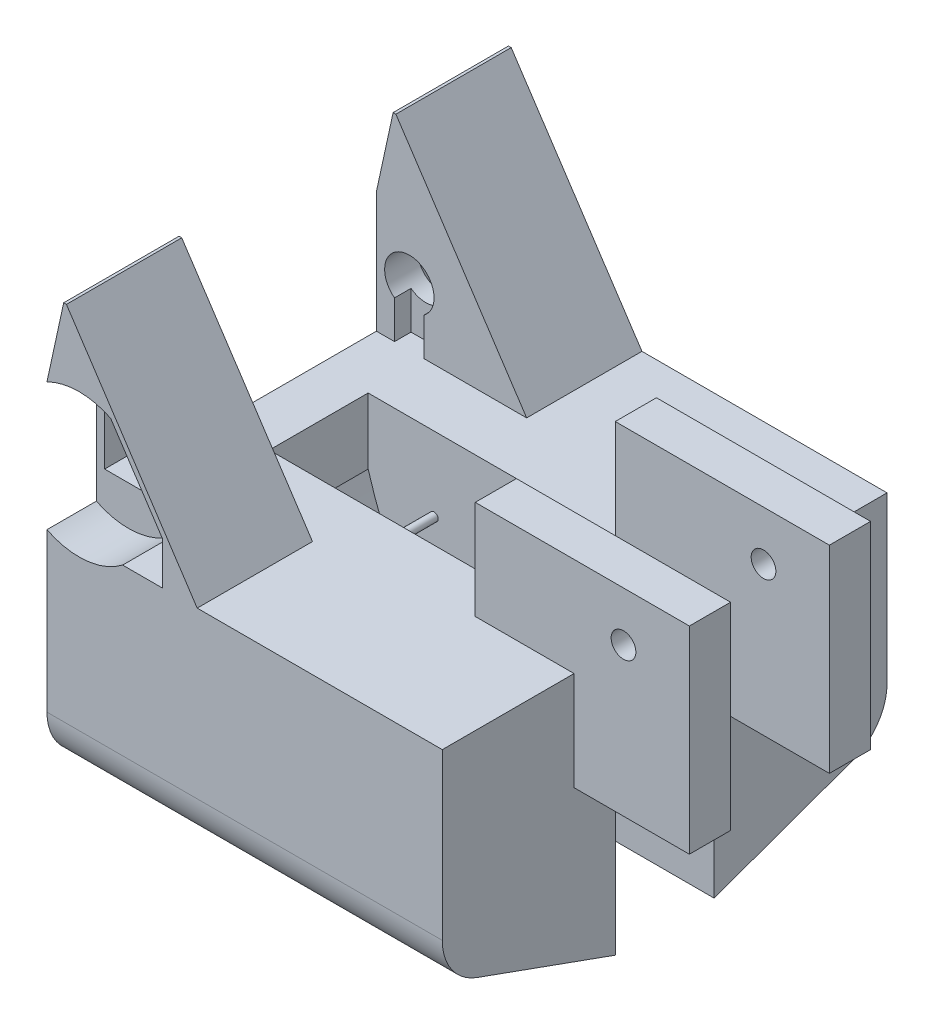
from build123d import *

# Parameters (mm, degrees)
EXTRUDE_1_DEPTH           = 30
EXTRUDE_2_DEPTH           = 210
SKETCH_8_W                = 25
SKETCH_8_H                = 120
EXTRUDE_5_DEPTH           = 70
SKETCH_9_W                = 25
SKETCH_9_H                = 60
EXTRUDE_6_DEPTH           = 60
SKETCH_10_R               = 7.5
CUT_EXTRUDE_3_DEPTH       = 402.372644808
EXTRUDE_7_DEPTH           = 60
EXTRUDE_8_REACH           = 392.16
SKETCH_12_R               = 2.5
SKETCH_14_W               = 125
SKETCH_14_H               = 50
EXTRUDE_9_DEPTH           = 120
SKETCH_15_W               = 70
SKETCH_15_H               = 70
CUT_EXTRUDE_4_DEPTH       = 10
CUT_EXTRUDE_5_DEPTH       = 20
SKETCH_17_R               = 43.471266984
CUT_EXTRUDE_6_DEPTH       = 428.317212384
EXTRUDE_10_DEPTH          = 20
EXTRUDE_11_DEPTH          = 20
CUT_EXTRUDE_7_DEPTH       = 434.012701892
CUT_EXTRUDE_8_DEPTH       = 434.012701892
EXTRUDE_19_REACH          = 446.86
EXTRUDE_20_DEPTH          = 20
EXTRUDE_21_DEPTH          = 20
EXTRUDE_START             = 20
EXTRUDE_22_DEPTH          = 20
CUT_EXTRUDE_9_DEPTH       = 30
CUT_EXTRUDE_11_DEPTH      = 407.201920232
CUT_EXTRUDE_11_DEPTH_BACK = 407.201920232
SKETCH_29_R               = 15
EXTRUDE_23_DEPTH          = 78.20324
SKETCH_33_W               = 30
SKETCH_33_H               = 40
CUT_EXTRUDE_14_DEPTH      = 20
SKETCH_34_W               = 18
SKETCH_34_H               = 35.300600551
CUT_EXTRUDE_15_DEPTH      = 10
CUT_EXTRUDE_16_DEPTH      = 10
SKETCH_36_RX              = 24.05
SKETCH_36_RY              = 15.9
SKETCH_36_R               = 15.9
CUT_EXTRUDE_17_DEPTH      = 4


with BuildPart() as part:
    # 草图1 → 凸台-拉伸1 (new body)
    with BuildSketch(Plane(origin=(0, 0, 0), x_dir=(0, 0, -1), z_dir=(1, 0, 0))):
        with BuildLine():
            Line((0, 0), (270, 0))
            Line((270, 0), (270, -100.282814983))
            ThreePointArc((270, -100.282814983), (264.178138298, -118.691056762), (248.830033233, -130.404003019))
            Line((248.830033233, -130.404003019), (142.45524498, -168.69892679))
            ThreePointArc((142.45524498, -168.69892679), (135, -170), (127.54475502, -168.69892679))
            Line((127.54475502, -168.69892679), (21.169966767, -130.404003019))
            ThreePointArc((21.169966767, -130.404003019), (5.821861702, -118.691056762), (0, -100.282814983))
            Line((0, -100.282814983), (0, 0))
        make_face()
    extrude(amount=EXTRUDE_1_DEPTH)

    # 草图2 → 凸台-拉伸2 (add)
    with BuildSketch(Plane(origin=(30, 0, 0), x_dir=(0, 0, -1), z_dir=(1, 0, 0))):
        with BuildLine():
            Line((105, -160.582814983), (105, 0))
            Line((105, 0), (0, 0))
            Line((0, 0), (0, -100.282814983))
            ThreePointArc((0, -100.282814983), (5.821861702, -118.691056762), (21.169966767, -130.404003019))
            Line((21.169966767, -130.404003019), (105, -160.582814983))
        make_face()
        with BuildLine():
            Line((270, 0), (165, 0))
            Line((165, 0), (165, -160.582814983))
            Line((165, -160.582814983), (248.830033233, -130.404003019))
            ThreePointArc((248.830033233, -130.404003019), (264.178138298, -118.691056762), (270, -100.282814983))
            Line((270, -100.282814983), (270, 0))
        make_face()
    extrude(amount=EXTRUDE_2_DEPTH)

    # 草图8 → 凸台-拉伸5 (add)
    with BuildSketch(Plane(origin=(240, 0, 0), x_dir=(0, 0, -1), z_dir=(1, 0, 0))):
        with Locations((92.5, 0)):
            Rectangle(SKETCH_8_W, SKETCH_8_H)
        with Locations((177.5, 0)):
            Rectangle(SKETCH_8_W, SKETCH_8_H)
    extrude(amount=EXTRUDE_5_DEPTH)

    # 草图9 → 凸台-拉伸6 (add)
    with BuildSketch(Plane.ZY.offset(-240)):
        with Locations((-92.5, 30)):
            Rectangle(SKETCH_9_W, SKETCH_9_H)
        with Locations((-177.5, 30)):
            Rectangle(SKETCH_9_W, SKETCH_9_H)
    extrude(amount=EXTRUDE_6_DEPTH)

    # 草图10 → 切除-拉伸3 (cut, through all)
    with BuildSketch(Plane.XY.offset(-80)):
        with Locations((270, 30)):
            Circle(SKETCH_10_R)
    extrude(amount=-CUT_EXTRUDE_3_DEPTH, mode=Mode.SUBTRACT)

    # 草图11 → 凸台-拉伸7 (add)
    with BuildSketch(Plane(origin=(0, 0, -105), x_dir=(-1, 0, 0), z_dir=(0, 0, -1))):
        with BuildLine():
            Line((-30, -40), (-30, -160.582814983))
            Line((-30, -160.582814983), (-108.203242822, -160.582814983))
            ThreePointArc((-108.203242822, -160.582814983), (-60.24964282, -106.032303748), (-30, -40))
        make_face()
    extrude(amount=EXTRUDE_7_DEPTH)

    # 草图12 → 凸台-拉伸8 (add, up to next)
    with BuildSketch(Plane.XY.offset(-165), mode=Mode.PRIVATE) as extrude_8_sk1:
        with Locations(Location((70, -45, 0), (0, 0, 180))):
            Circle(SKETCH_12_R)
    extrude_8_tool1 = extrude(extrude_8_sk1.sketch, amount=EXTRUDE_8_REACH, mode=Mode.PRIVATE) - part.part
    add(extrude_8_tool1.solids().sort_by_distance((70, -45, -165))[0])

    # 草图14 → 凸台-拉伸9 (add)
    with BuildSketch(Plane(origin=(0, 0, 0), x_dir=(1, 0, 0), z_dir=(0, 1, 0))):
        with Locations((62.5, 225)):
            Rectangle(SKETCH_14_W, SKETCH_14_H)
        with Locations((62.5, 45)):
            Rectangle(SKETCH_14_W, SKETCH_14_H)
    extrude(amount=EXTRUDE_9_DEPTH)

    # 草图15 → 切除-拉伸4 (cut)
    with BuildSketch(Plane.XY.offset(-20)):
        with Locations((35, 35)):
            Rectangle(SKETCH_15_W, SKETCH_15_H)
    extrude(amount=-CUT_EXTRUDE_4_DEPTH, mode=Mode.SUBTRACT)

    # 草图16 → 切除-拉伸5 (cut)
    with BuildSketch(Plane.XY.offset(-30)):
        Polygon((35, 15), (5, 15), (5, 55), (35, 55), (35, 35), align=None)
    extrude(amount=-CUT_EXTRUDE_5_DEPTH, mode=Mode.SUBTRACT)

    # 草图17 → 切除-拉伸6 (cut, through all)
    with BuildSketch(Plane.XY.offset(-30)):
        with Locations((19.5, 34.5)):
            Circle(SKETCH_17_R)
    extrude(amount=CUT_EXTRUDE_6_DEPTH, mode=Mode.SUBTRACT)

    # 草图18 → 凸台-拉伸10 (add)
    with BuildSketch(Plane.XY.offset(-20)):
        Polygon((11.819921283, 120), (91.211474189, 0), (87.317867735, 0), (10.741661946, 115.744614613), align=None)
    extrude(amount=EXTRUDE_10_DEPTH)

    # 草图19 → 凸台-拉伸11 (add)
    with BuildSketch(Plane.XY.offset(-20)):
        with BuildLine():
            Line((1.857343832, 74.230186717), (10.856035233, 115.571739869))
            Line((10.856035233, 115.571739869), (10.741661946, 115.744614613))
            Line((10.741661946, 115.744614613), (11.819921283, 120))
            Line((11.819921283, 120), (10.153664863, 120))
            Line((10.153664863, 120), (0, 73.352297914))
            ThreePointArc((0, 73.352297914), (0.923485284, 73.80221564), (1.857343832, 74.230186717))
        make_face()
    extrude(amount=EXTRUDE_11_DEPTH)

    # 草图20 → 切除-拉伸7 (cut, through all)
    with BuildSketch(Plane.XY.offset(-20)):
        Polygon((0, 120), (0, 73.352297914), (10.153664863, 120), align=None)
    extrude(amount=-CUT_EXTRUDE_7_DEPTH, mode=Mode.SUBTRACT)

    # 草图22 → 切除-拉伸8 (cut, through all)
    with BuildSketch(Plane.XY.offset(-20)):
        Polygon((44.899734993, 70), (70, 32.061054476), (91.211474189, 0), (125, 0), (125, 120), (11.819921283, 120), align=None)
    extrude(amount=-CUT_EXTRUDE_8_DEPTH, mode=Mode.SUBTRACT)

    # 草图23 → 凸台-拉伸19 (add, up to next)
    with BuildSketch(Plane.XY, mode=Mode.PRIVATE) as extrude_19_sk1:
        with BuildLine():
            Line((87.317867735, 0), (91.211474189, 0))
            Line((91.211474189, 0), (11.819921283, 120))
            Line((11.819921283, 120), (10.153664863, 120))
            Line((10.153664863, 120), (0, 73.352297914))
            ThreePointArc((0, 73.352297914), (0.923485284, 73.80221564), (1.857343832, 74.230186717))
            Line((1.857343832, 74.230186717), (10.856035233, 115.571739869))
            Line((10.856035233, 115.571739869), (87.317867735, 0))
        make_face()
    extrude_19_tool1 = extrude(extrude_19_sk1.sketch, amount=-EXTRUDE_19_REACH, mode=Mode.PRIVATE) - part.part
    add(extrude_19_tool1.solids().sort_by_distance((89.264671, 1.5073, 0))[0])

    # 草图24 → 凸台-拉伸20 (add)
    with BuildSketch(Plane.XY.offset(-20)):
        Polygon((87.317867735, 0), (70, 26.175884614), (70, 0), align=None)
    extrude(amount=EXTRUDE_20_DEPTH)

    # 草图25 → 凸台-拉伸21 (add)
    with BuildSketch(Plane.XY.offset(-20)):
        with BuildLine():
            Line((38.684579851, 73.509011127), (10.856035233, 115.571739869))
            Line((10.856035233, 115.571739869), (1.857343832, 74.230186717))
            ThreePointArc((1.857343832, 74.230186717), (20.351120273, 77.962934179), (38.684579851, 73.509011127))
        make_face()
    extrude(amount=EXTRUDE_21_DEPTH)

    # 草图26 → 凸台-拉伸22 (add)
    with BuildSketch(Plane(origin=(0, 0, -250), x_dir=(-1, 0, 0), z_dir=(0, 0, -1)).offset(EXTRUDE_START)):
        with BuildLine():
            Line((-70, 26.175884614), (-38.684579851, 73.509011127))
            ThreePointArc((-38.684579851, 73.509011127), (-19.323897117, 77.970910285), (0, 73.352297914))
            Line((0, 73.352297914), (-10.153664863, 120))
            Line((-10.153664863, 120), (-11.819921283, 120))
            Line((-11.819921283, 120), (-91.211474189, 0))
            Line((-91.211474189, 0), (-240, 0))
            Line((-240, 0), (-240, -100.282814983))
            Line((-240, -100.282814983), (0, -100.282814983))
            Line((0, -100.282814983), (0, -4.352297914))
            ThreePointArc((0, -4.352297914), (-23.599339693, -8.77755154), (-45.948082222, 0))
            Line((-45.948082222, 0), (-70, 0))
            Line((-70, 0), (-70, 26.175884614))
        make_face()
    extrude(amount=-EXTRUDE_22_DEPTH)

    # 草图27 → 切除-拉伸9 (cut)
    with BuildSketch(Plane(origin=(0, 0, -270), x_dir=(-1, 0, 0), z_dir=(0, 0, -1))):
        with BuildLine():
            Line((-38.684579851, 73.509011127), (-70, 26.175884614))
            Line((-70, 26.175884614), (-70, 0))
            Line((-70, 0), (-45.948082222, 0))
            ThreePointArc((-45.948082222, 0), (-23.599339693, -8.77755154), (0, -4.352297914))
            Line((0, -4.352297914), (0, 73.352297914))
            ThreePointArc((0, 73.352297914), (-19.323897117, 77.970910285), (-38.684579851, 73.509011127))
        make_face()
    extrude(amount=-CUT_EXTRUDE_9_DEPTH, mode=Mode.SUBTRACT)

    # 草图29 → 切除-拉伸11 (cut, two sides: drawn at the far end of the back side and taken through both)
    with BuildSketch(Plane(origin=(0, 0, -70), x_dir=(-1, 0, 0), z_dir=(0, 0, -1)).offset(-CUT_EXTRUDE_11_DEPTH_BACK)):
        with Locations((-20, 35)):
            Circle(SKETCH_29_R)
    extrude(amount=CUT_EXTRUDE_11_DEPTH + CUT_EXTRUDE_11_DEPTH_BACK, mode=Mode.SUBTRACT)

    # 草图30 → 凸台-拉伸23 (add)
    with BuildSketch(Plane(origin=(30, 0, 0), x_dir=(0, 0, -1), z_dir=(1, 0, 0))):
        with BuildLine():
            Line((142.45524498, -168.69892679), (165, -160.582814983))
            Line((165, -160.582814983), (105, -160.582814983))
            Line((105, -160.582814983), (127.54475502, -168.69892679))
            ThreePointArc((127.54475502, -168.69892679), (135, -170), (142.45524498, -168.69892679))
        make_face()
    extrude(amount=EXTRUDE_23_DEPTH)

    # 草图33 → 切除-拉伸14 (cut)
    with BuildSketch(Plane(origin=(0, 0, -240), x_dir=(-1, 0, 0), z_dir=(0, 0, -1))):
        with Locations((-20, 35)):
            Rectangle(SKETCH_33_W, SKETCH_33_H)
    extrude(amount=-CUT_EXTRUDE_14_DEPTH, mode=Mode.SUBTRACT)

    # 草图34 → 切除-拉伸15 (cut)
    with BuildSketch(Plane.XY.offset(-200)):
        with Locations((20, 17.650300276)):
            Rectangle(SKETCH_34_W, SKETCH_34_H)
    extrude(amount=-CUT_EXTRUDE_15_DEPTH, mode=Mode.SUBTRACT)

    # 草图35 → 切除-拉伸16 (cut)
    with BuildSketch(Plane(origin=(0, 0, -70), x_dir=(-1, 0, 0), z_dir=(0, 0, -1))):
        with BuildLine():
            Line((-11, 0), (-11, 23))
            ThreePointArc((-11, 23), (-20, 20), (-29, 23))
            Line((-29, 23), (-29, 0))
            Line((-29, 0), (-11, 0))
        make_face()
    extrude(amount=-CUT_EXTRUDE_16_DEPTH, mode=Mode.SUBTRACT)

    # 草图36 → 切除-拉伸17 (cut)
    # profile 1 of 6: a face of its own
    with BuildSketch(Plane.ZY):
        with Locations((-235.69166945, -100.008005659)):
            Ellipse(SKETCH_36_RX, SKETCH_36_RY)
        with Locations((-235.69166945, -100.008005659)):
            Circle(SKETCH_36_R, mode=Mode.SUBTRACT)
    # profile 2 of 6: a face of its own
    with BuildSketch(Plane.ZY):
        with Locations((-235.69166945, -100.008005659)):
            Ellipse(SKETCH_36_RX, SKETCH_36_RY)
        with Locations((-235.69166945, -100.008005659)):
            Circle(SKETCH_36_R, mode=Mode.SUBTRACT)
    # profile 3 of 6: a face of its own
    with BuildSketch(Plane.ZY):
        with Locations((-235.69166945, -100.008005659)):
            Circle(SKETCH_36_R)
    # profile 4 of 6: a face of its own
    with BuildSketch(Plane.ZY):
        with Locations(Location((-34.30833055, -100.008005659), (0, 0, 180))):
            Ellipse(SKETCH_36_RX, SKETCH_36_RY)
        with Locations((-34.30833055, -100.008005659)):
            Circle(SKETCH_36_R, mode=Mode.SUBTRACT)
    # profile 5 of 6: a face of its own
    with BuildSketch(Plane.ZY):
        with Locations(Location((-34.30833055, -100.008005659), (0, 0, 180))):
            Ellipse(SKETCH_36_RX, SKETCH_36_RY)
        with Locations((-34.30833055, -100.008005659)):
            Circle(SKETCH_36_R, mode=Mode.SUBTRACT)
    # profile 6 of 6: a face of its own
    with BuildSketch(Plane.ZY):
        with Locations((-34.30833055, -100.008005659)):
            Circle(SKETCH_36_R)
    extrude(amount=-CUT_EXTRUDE_17_DEPTH, mode=Mode.SUBTRACT)


solid = part.part
